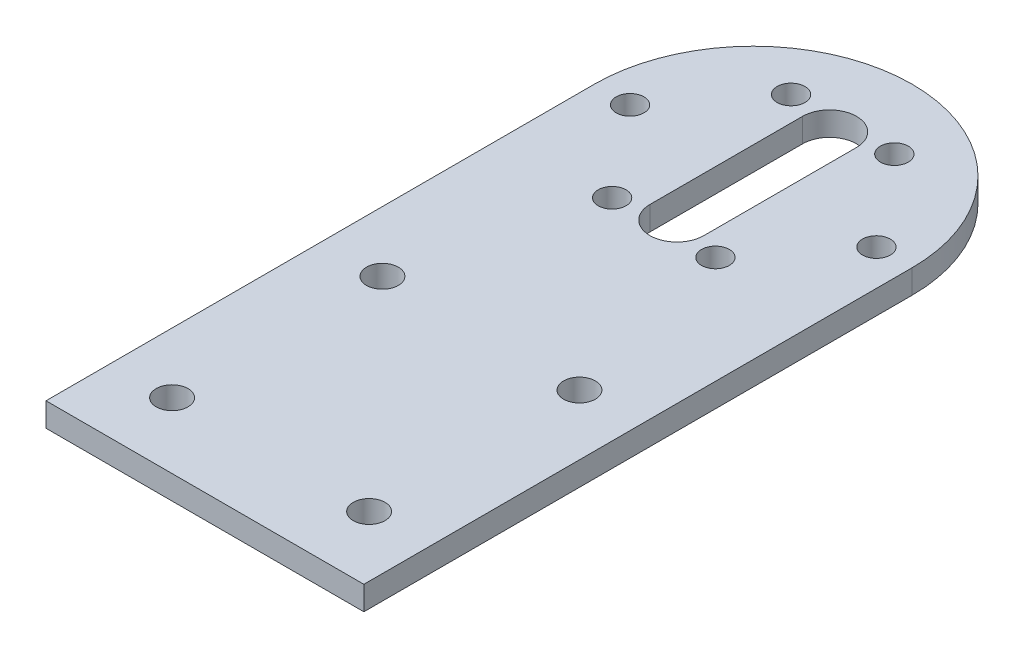
from build123d import *

# Parameters (mm, degrees)
SKETCH_1_R      = 1.75
SKETCH_1_R_2    = 2
EXTRUDE_1_DEPTH = 3


with BuildPart() as part:
    # 草图1 → 凸台-拉伸1 (new body)
    with BuildSketch(Plane(origin=(0, 0, 0), x_dir=(1, 0, 0), z_dir=(0, 1, 0))):
        with BuildLine():
            Line((-20, 0), (-20, -69))
            Line((-20, -69), (20, -69))
            Line((20, -69), (20, 0))
            ThreePointArc((20, 0), (0, 20), (-20, 0))
        make_face()
        with Locations(Location((-6.5, 11.258330249, 0), (0, 0, 270))):
            Circle(SKETCH_1_R, mode=Mode.SUBTRACT)
        with Locations(Location((6.5, 11.258330249, 0), (0, 0, 270))):
            Circle(SKETCH_1_R, mode=Mode.SUBTRACT)
        with Locations(Location((-15.5, 0, 0), (0, 0, 270))):
            Circle(SKETCH_1_R, mode=Mode.SUBTRACT)
        with Locations(Location((15.5, 0, 0), (0, 0, 270))):
            Circle(SKETCH_1_R, mode=Mode.SUBTRACT)
        with Locations(Location((-6.5, -11.258330249, 0), (0, 0, 270))):
            Circle(SKETCH_1_R, mode=Mode.SUBTRACT)
        with Locations(Location((6.5, -11.258330249, 0), (0, 0, 270))):
            Circle(SKETCH_1_R, mode=Mode.SUBTRACT)
        with Locations(Location((-12.398128108, -34.265032361, 0), (0, 0, 270))):
            Circle(SKETCH_1_R_2, mode=Mode.SUBTRACT)
        with Locations(Location((-12.398128108, -60.734967639, 0), (0, 0, 270))):
            Circle(SKETCH_1_R_2, mode=Mode.SUBTRACT)
        with Locations(Location((12.398128108, -34.265032361, 0), (0, 0, 270))):
            Circle(SKETCH_1_R_2, mode=Mode.SUBTRACT)
        with Locations(Location((12.398128108, -60.734967639, 0), (0, 0, 270))):
            Circle(SKETCH_1_R_2, mode=Mode.SUBTRACT)
        with BuildLine():
            Line((3.394790848, 9.605209152), (3.394790848, -9.605209152))
            ThreePointArc((3.394790848, -9.605209152), (0, -13), (-3.394790848, -9.605209152))
            Line((-3.394790848, -9.605209152), (-3.394790848, 9.605209152))
            ThreePointArc((-3.394790848, 9.605209152), (0, 13), (3.394790848, 9.605209152))
        make_face(mode=Mode.SUBTRACT)
    extrude(amount=EXTRUDE_1_DEPTH)


solid = part.part
